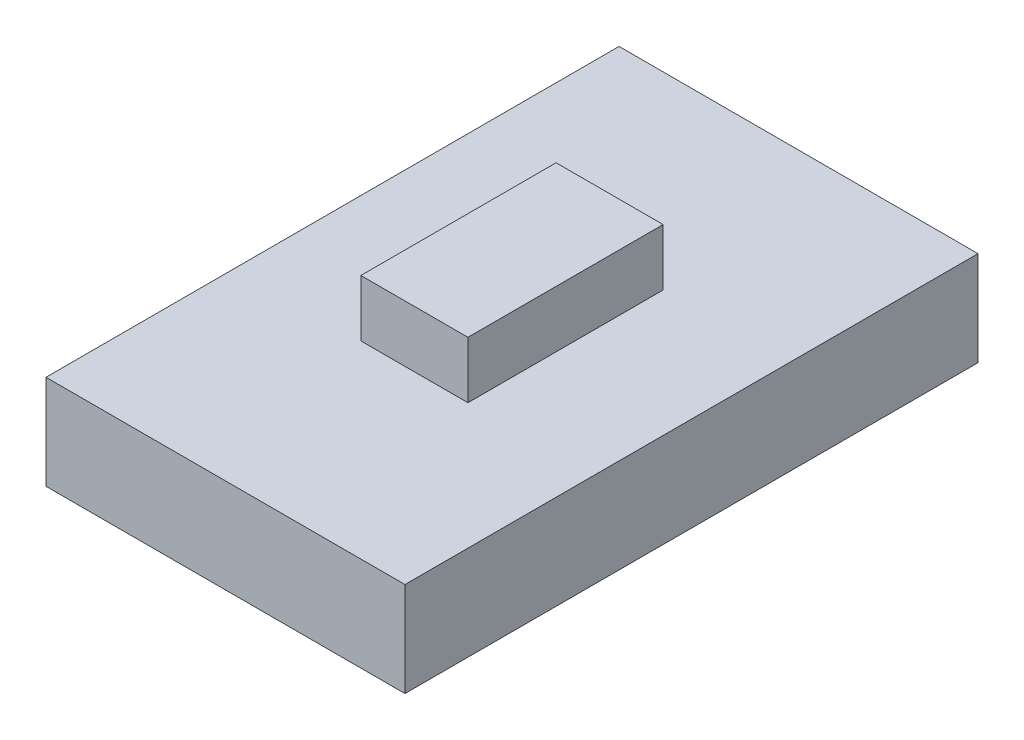
from build123d import *

# Parameters (mm, degrees)
SKETCH1_W           = 0.85
SKETCH1_H           = 1.55
BOSS_EXTRUDE1_DEPTH = 0.45
BOSS_EXTRUDE2_DEPTH = 0.75


with BuildPart() as part:
    # Sketch1 → Boss-Extrude1 (new body)
    with BuildSketch(Plane(origin=(0, 0, 0), x_dir=(1, 0, 0), z_dir=(0, 1, 0))):
        with Locations((0.425, 0.775)):
            Rectangle(SKETCH1_W, SKETCH1_H)
    extrude(amount=BOSS_EXTRUDE1_DEPTH)

    # Sketch2 → Boss-Extrude2 (add)
    with BuildSketch(Plane.XZ):
        Polygon((0.425, 1.5), (-1, 1.5), (-1, -3.05), (1.85, -3.05), (1.85, 1.5), align=None)
    extrude(amount=BOSS_EXTRUDE2_DEPTH)


solid = part.part
